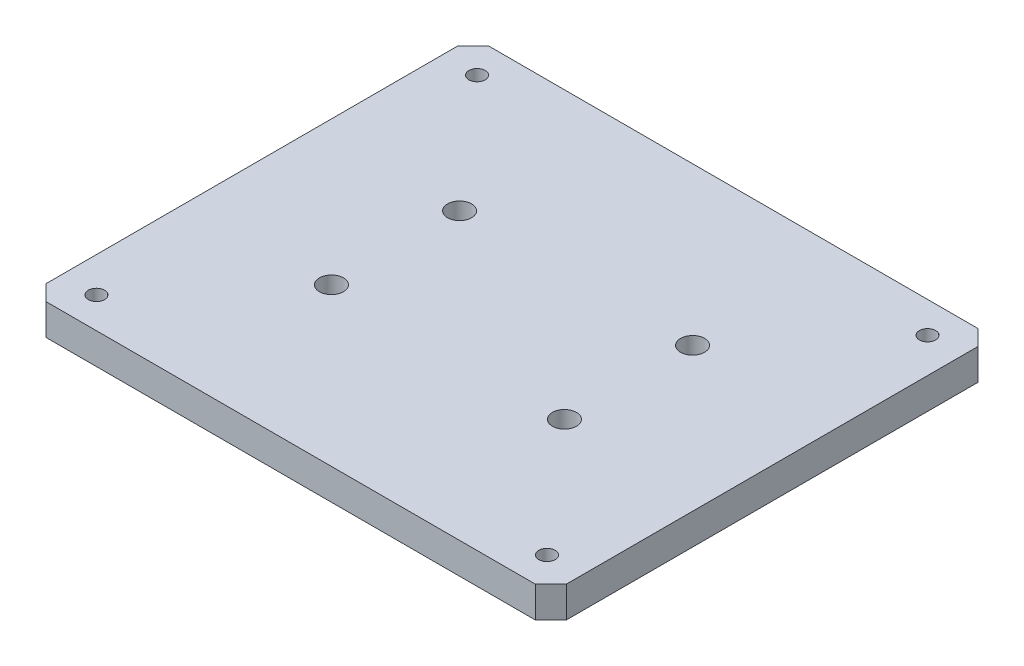
from build123d import *

# Parameters (mm, degrees)
SKETCH1_W           = 67
SKETCH1_H           = 57
SKETCH1_R           = 1.55
BOSS_EXTRUDE1_DEPTH = 4
SKETCH2_R           = 1.05
CUT_EXTRUDE1_DEPTH  = 45.164465354
CHAMFER1_SIZE       = 2


with BuildPart() as part:
    # Sketch1 → Boss-Extrude1 (new body)
    with BuildSketch(Plane(origin=(0, 0, 0), x_dir=(1, 0, 0), z_dir=(0, 1, 0))):
        Rectangle(SKETCH1_W, SKETCH1_H)
        with Locations(Location((15, 8.25, 0), (0, 0, 270))):
            Circle(SKETCH1_R, mode=Mode.SUBTRACT)
        with Locations(Location((-15, 8.25, 0), (0, 0, 90))):
            Circle(SKETCH1_R, mode=Mode.SUBTRACT)
        with Locations(Location((-15, -8.25, 0), (0, 0, 270))):
            Circle(SKETCH1_R, mode=Mode.SUBTRACT)
        with Locations(Location((15, -8.25, 0), (0, 0, 90))):
            Circle(SKETCH1_R, mode=Mode.SUBTRACT)
    extrude(amount=BOSS_EXTRUDE1_DEPTH)

    # Sketch2 → Cut-Extrude1 (cut, through all)
    with BuildSketch(Plane(origin=(0, 4, 0), x_dir=(1, 0, 0), z_dir=(0, 1, 0))):
        with Locations(Location((29, 24.5, 0), (0, 0, 270))):
            Circle(SKETCH2_R)
        with Locations(Location((-29, 24.5, 0), (0, 0, 90))):
            Circle(SKETCH2_R)
        with Locations(Location((-29, -24.5, 0), (0, 0, 270))):
            Circle(SKETCH2_R)
        with Locations(Location((29, -24.5, 0), (0, 0, 90))):
            Circle(SKETCH2_R)
    extrude(amount=-CUT_EXTRUDE1_DEPTH, mode=Mode.SUBTRACT)

    # Chamfer1
    chamfer1_edges = [part.edges().sort_by_distance(p)[0] for p in [
        (33.5, 2, 28.5),
        (-33.5, 2, 28.5),
        (-33.5, 2, -28.5),
        (33.5, 2, -28.5),
    ]]
    chamfer(chamfer1_edges, length=CHAMFER1_SIZE)


solid = part.part
